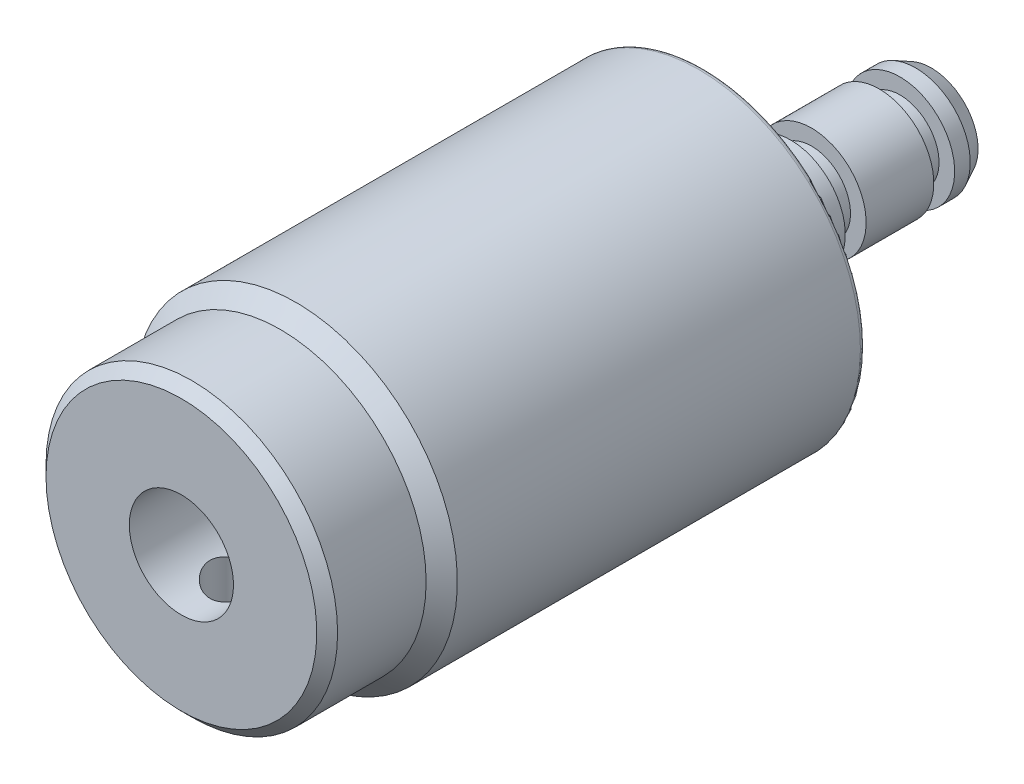
from build123d import *

# Parameters (mm, degrees)
OUTSIDE_BOTTOM_FILLET_R   = 0.25
TOP_CHAMFER_SIZE          = 0.5
M3X0_5_TAPPED_HOLE_REACH  = 39.303
M3X0_5_TAPPED_HOLE_BORE_R = 1.25


with BuildPart() as part:
    # Body Sketch → Body Revolve (revolve)
    with BuildSketch(Plane(origin=(0, 0, 0), x_dir=(1, 0, 0), z_dir=(0, 1, 0)), mode=Mode.PRIVATE) as body_revolve_sk:
        Polygon((2.5, -36), (7, -36), (7, -31.25), (7.75, -30.5), (7.75, -10.9), (6, -10.9), (2.625, -7.75), (2.625, -6.75), (1.875, -6.75), (1.875, -5.75), (2.625, -5.75), (2.625, -2.5), (1.875, -2.5), (1.875, -1.5), (2.625, -1.5), (2.625, -0.75), (2.25, 0), (1.5, 0), (1.5, -30.422649731), (2.5, -31), align=None)
    revolve(body_revolve_sk.sketch.rotate(Axis((0, 0, 0), (0, 0, 1)), 180), axis=Axis((0, 0, 0), (0, 0, 1)))

    # Outside Bottom Fillet
    outside_bottom_fillet_edges = [part.edges().sort_by_distance(p)[0] for p in [
        (7.75, 0, 10.9),
    ]]
    fillet(outside_bottom_fillet_edges, radius=OUTSIDE_BOTTOM_FILLET_R)

    # Top Chamfer
    top_chamfer_edges = [part.edges().sort_by_distance(p)[0] for p in [
        (7, 0, 36),
    ]]
    chamfer(top_chamfer_edges, length=TOP_CHAMFER_SIZE)

    # M3x0.5 Tapped Hole bore (on position points) → M3x0.5 Tapped Hole (cut, up to next)
    with BuildSketch(Plane(origin=(0, -7, 33.375), x_dir=(-1, 0, 0), z_dir=(0, -1, 0)), mode=Mode.PRIVATE) as m3x0_5_tapped_hole_sk1:
        Circle(M3X0_5_TAPPED_HOLE_BORE_R)
    m3x0_5_tapped_hole_tool1 = extrude(m3x0_5_tapped_hole_sk1.sketch, amount=-M3X0_5_TAPPED_HOLE_REACH, mode=Mode.PRIVATE) & part.part
    add(m3x0_5_tapped_hole_tool1.solids().sort_by_distance((0, -7, 33.375))[0], mode=Mode.SUBTRACT)


solid = part.part
